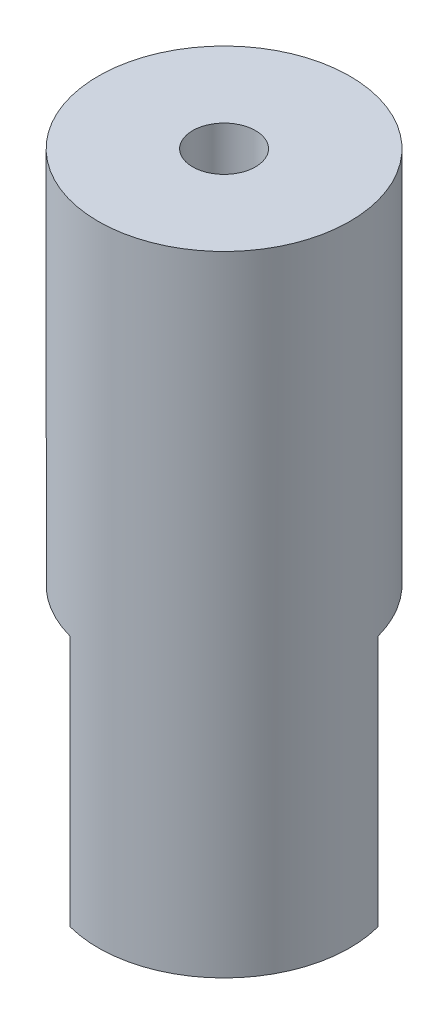
from build123d import *

# Parameters (mm, degrees)
SKETCH1_R               = 10
BOSS_EXTRUDE1_DEPTH     = 30
F_5_0MM_DOWEL_HOLE1_D   = 5
SALIENTE_EXTRUIR1_START = 20
SALIENTE_EXTRUIR1_DEPTH = 20


with BuildPart() as part:
    # Sketch1 → Boss-Extrude1 (new body)
    with BuildSketch(Plane(origin=(0, 0, 0), x_dir=(1, 0, 0), z_dir=(0, 1, 0))):
        with Locations(Location((0, 0, 0), (0, 0, 270))):
            Circle(SKETCH1_R)
    extrude(amount=BOSS_EXTRUDE1_DEPTH)

    # Ø5.0mm Dowel Hole1 (through all)
    with Locations(Plane(origin=(0, 30, 0), x_dir=(1, 0, 0), z_dir=(0, 1, 0))):
        with Locations((0, 0)):
            Hole(F_5_0MM_DOWEL_HOLE1_D / 2)

    # Croquis1 → Saliente-Extruir1 (add)
    with BuildSketch(Plane.XZ.offset(SALIENTE_EXTRUIR1_START)):
        with BuildLine():
            Line((9.659258263, -2.588190451), (-2.588190451, 9.659258263))
            ThreePointArc((-2.588190451, 9.659258263), (7.071067812, 7.071067812), (9.659258263, -2.588190451))
        make_face()
    extrude(amount=-SALIENTE_EXTRUIR1_DEPTH)


solid = part.part
